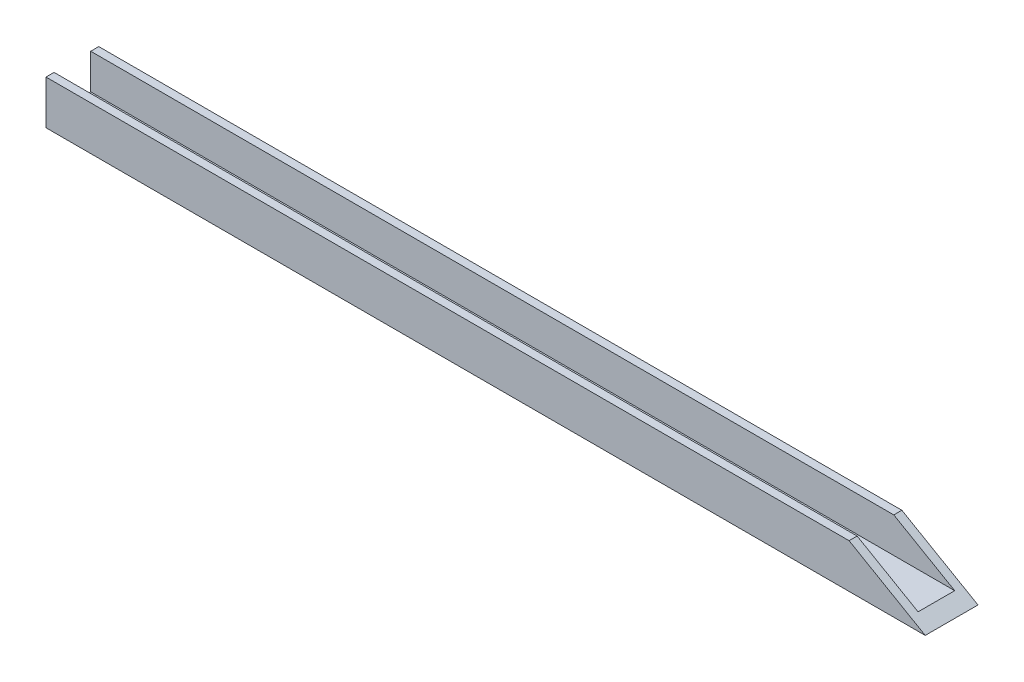
from build123d import *

# Parameters (mm, degrees)
SKETCH1_W           = 100
SKETCH1_H           = 6
BOSS_EXTRUDE1_DEPTH = 5
SKETCH2_W           = 100
SKETCH2_H           = 4.1675
CUT_EXTRUDE1_DEPTH  = 4
CUT_EXTRUDE2_DEPTH  = 20


with BuildPart() as part:
    # Sketch1 → Boss-Extrude1 (new body)
    with BuildSketch(Plane(origin=(0, 0, 0), x_dir=(1, 0, 0), z_dir=(0, 1, 0))):
        Rectangle(SKETCH1_W, SKETCH1_H)
    extrude(amount=BOSS_EXTRUDE1_DEPTH)

    # Sketch2 → Cut-Extrude1 (cut)
    with BuildSketch(Plane(origin=(0, 5, 0), x_dir=(1, 0, 0), z_dir=(0, 1, 0))):
        Rectangle(SKETCH2_W, SKETCH2_H)
    extrude(amount=-CUT_EXTRUDE1_DEPTH, mode=Mode.SUBTRACT)

    # Sketch3 → Cut-Extrude2 (cut)
    with BuildSketch(Plane.XY.offset(3)):
        Polygon((50, 0), (41.339745962, 5), (50, 5), align=None)
    extrude(amount=-CUT_EXTRUDE2_DEPTH, mode=Mode.SUBTRACT)


solid = part.part
